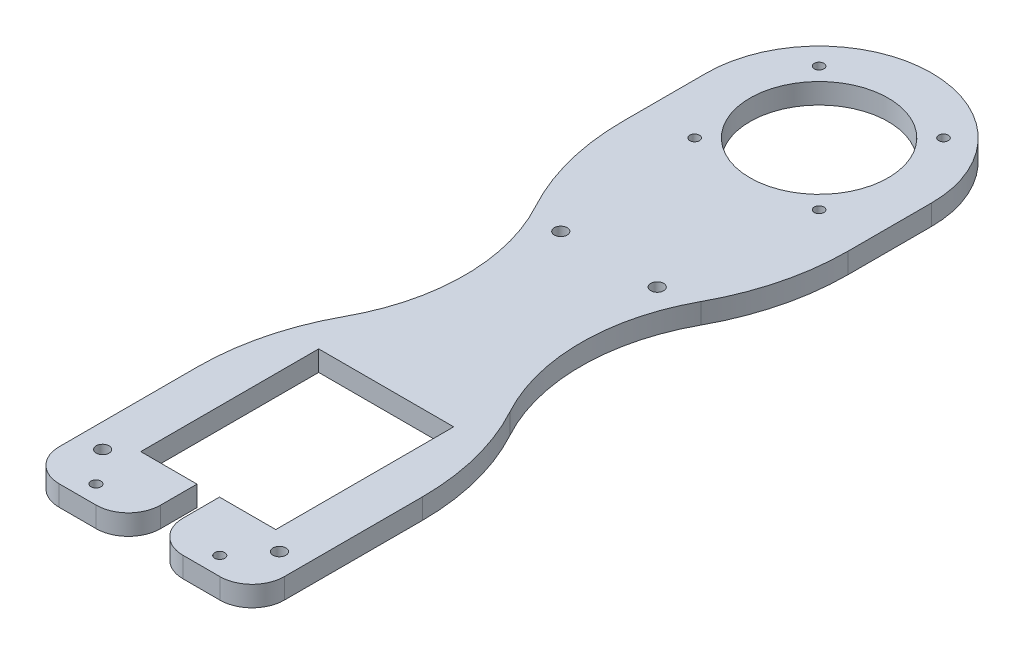
from build123d import *

# Parameters (mm, degrees)
BOSS_EXTRUDE1_DEPTH = 3.175
SKETCH2_R           = 21.5
CUT_EXTRUDE1_DEPTH  = 215.322525648
SKETCH3_W           = 42
SKETCH3_H           = 55.35
SKETCH3_W_2         = 7
SKETCH3_H_2         = 21.35
CUT_EXTRUDE2_DEPTH  = 215.322525648
SKETCH4_R           = 1.5
CUT_EXTRUDE3_DEPTH  = 215.322525648
FILLET1_R           = 10
SKETCH5_R           = 2
CUT_EXTRUDE4_DEPTH  = 215.322525648
CUT_EXTRUDE5_DEPTH  = 215.322525648
FILLET3_R           = 76
SKETCH7_R           = 1.55
CUT_EXTRUDE6_DEPTH  = 215.322525648


with BuildPart() as part:
    # Sketch1 → Boss-Extrude1 (new, symmetric)
    with BuildSketch(Plane(origin=(0, 0, 0), x_dir=(1, 0, 0), z_dir=(0, 1, 0))):
        with BuildLine():
            Line((35, -211.35), (35, 0))
            ThreePointArc((35, 0), (0, 35), (-35, 0))
            Line((-35, 0), (-35, -211.35))
            Line((-35, -211.35), (35, -211.35))
        make_face()
    extrude(amount=BOSS_EXTRUDE1_DEPTH, both=True)

    # Sketch2 → Cut-Extrude1 (cut, through all)
    with BuildSketch(Plane(origin=(0, 3.175, 0), x_dir=(1, 0, 0), z_dir=(0, 1, 0))):
        with Locations(Location((0, 0, 0), (0, 0, 270))):
            Circle(SKETCH2_R)
    extrude(amount=-CUT_EXTRUDE1_DEPTH, mode=Mode.SUBTRACT)

    # Sketch3 → Cut-Extrude2 (cut, through all)
    with BuildSketch(Plane(origin=(0, 3.175, 0), x_dir=(1, 0, 0), z_dir=(0, 1, 0))):
        with Locations((0, -162.325)):
            Rectangle(SKETCH3_W, SKETCH3_H)
        with Locations((0, -200.675)):
            Rectangle(SKETCH3_W_2, SKETCH3_H_2)
    extrude(amount=-CUT_EXTRUDE2_DEPTH, mode=Mode.SUBTRACT)

    # Sketch4 → Cut-Extrude3 (cut, through all)
    with BuildSketch(Plane(origin=(0, 3.175, 0), x_dir=(1, 0, 0), z_dir=(0, 1, 0))):
        with Locations(Location((-19.35, 19.35, 0), (0, 0, 270))):
            Circle(SKETCH4_R)
        with Locations(Location((19.35, 19.35, 0), (0, 0, 270))):
            Circle(SKETCH4_R)
        with Locations(Location((19.35, -19.35, 0), (0, 0, 270))):
            Circle(SKETCH4_R)
        with Locations(Location((-19.35, -19.35, 0), (0, 0, 270))):
            Circle(SKETCH4_R)
    extrude(amount=-CUT_EXTRUDE3_DEPTH, mode=Mode.SUBTRACT)

    # Fillet1
    fillet1_edges = [part.edges().sort_by_distance(p)[0] for p in [
        (3.5, 0, 211.35),
        (-3.5, 0, 211.35),
        (35, 0, 211.35),
        (-35, 0, 211.35),
    ]]
    fillet(fillet1_edges, radius=FILLET1_R)

    # Sketch5 → Cut-Extrude4 (cut, through all)
    with BuildSketch(Plane(origin=(0, 3.175, 0), x_dir=(1, 0, 0), z_dir=(0, 1, 0))):
        with Locations(Location((-15, -65.35, 0), (0, 0, 270))):
            Circle(SKETCH5_R)
        with Locations(Location((15, -65.35, 0), (0, 0, 270))):
            Circle(SKETCH5_R)
        with Locations(Location((-27.5, -195.35, 0), (0, 0, 270))):
            Circle(SKETCH5_R)
        with Locations(Location((27.5, -195.35, 0), (0, 0, 270))):
            Circle(SKETCH5_R)
    extrude(amount=-CUT_EXTRUDE4_DEPTH, mode=Mode.SUBTRACT)

    # Sketch6 → Cut-Extrude5 (cut, through all)
    with BuildSketch(Plane.XZ.offset(3.175)):
        with BuildLine():
            Line((-35, 49.65), (-35, 134.65))
            ThreePointArc((-35, 134.65), (-18.102907984, 92.15), (-35, 49.65))
        make_face()
    cut_extrude5 = extrude(amount=-CUT_EXTRUDE5_DEPTH, mode=Mode.SUBTRACT)

    # Mirror1: Cut-Extrude5 across plane
    add(cut_extrude5.mirror(Plane(origin=(0, 0, 0), x_dir=(0, 0, 1), z_dir=(1, 0, 0))), mode=Mode.SUBTRACT)

    # Fillet3
    fillet3_edges = [part.edges().sort_by_distance(p)[0] for p in [
        (-35, 0, 134.65),
        (-35, 0, 49.65),
        (35, 0, 49.65),
        (35, 0, 134.65),
    ]]
    fillet(fillet3_edges, radius=FILLET3_R)

    # Sketch7 → Cut-Extrude6 (cut, through all)
    with BuildSketch(Plane.XZ.offset(3.175)):
        with Locations(Location((-19.25, 205.675, 0), (0, 0, 270))):
            Circle(SKETCH7_R)
        with Locations(Location((19.25, 205.675, 0), (0, 0, 270))):
            Circle(SKETCH7_R)
    extrude(amount=-CUT_EXTRUDE6_DEPTH, mode=Mode.SUBTRACT)


solid = part.part
